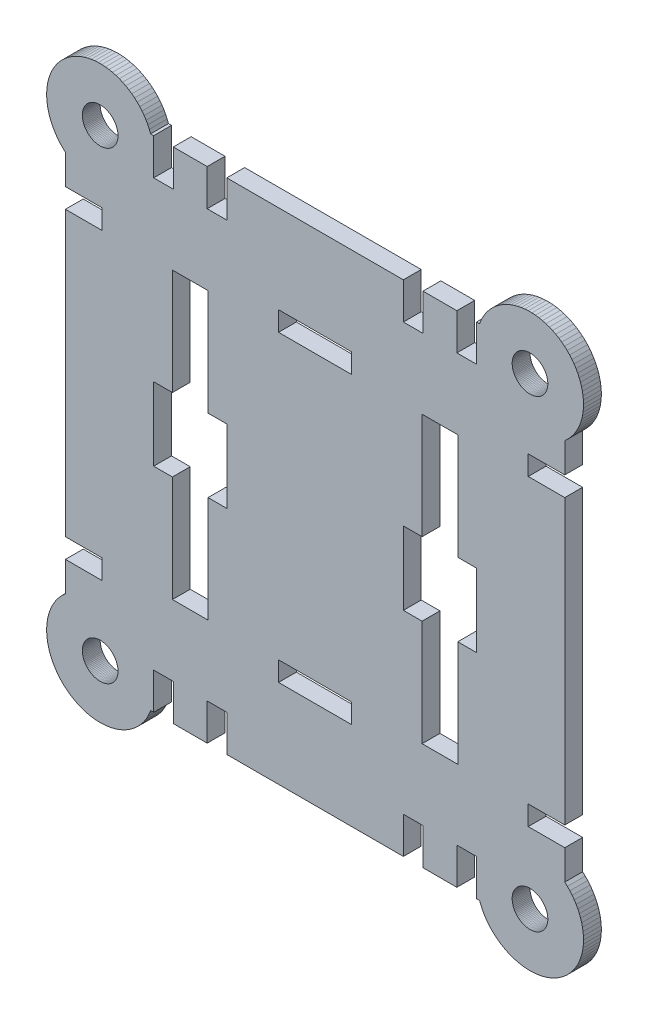
from build123d import *

# Parameters (mm, degrees)
SKETCH2_W           = 20.5
SKETCH2_H           = 5.5
BOSS_EXTRUDE1_DEPTH = 2.5


with BuildPart() as part:
    # Sketch2 → Boss-Extrude1 (new, symmetric)
    with BuildSketch(Plane.XY):
        Polygon((-1666.454340614, -187.547004833), (-1656.204340614, -187.547004833), (-1656.204340614, -182.047004833), (-1666.454340614, -182.047004833), (-1666.454340614, -102.54700992), (-1656.204340614, -102.54700992), (-1656.204340614, -97.04700992), (-1666.454340614, -97.04700992), (-1666.454342796, -88.695582594), (-1667.191682261, -88.021043185), (-1667.882472778, -87.29890255), (-1668.523646043, -86.532367827), (-1669.112356161, -85.724841337), (-1669.645990101, -84.879907343), (-1670.12217929, -84.001316146), (-1670.538810128, -83.092967435), (-1670.89403337, -82.158892981), (-1671.186272331, -81.203238742), (-1671.414229889, -80.230246456), (-1671.576894236, -79.24423482), (-1671.673543376, -78.249580318), (-1671.703748325, -77.250697793), (-1671.667375015, -76.252020859), (-1671.564584892, -75.257982215), (-1671.395834198, -74.272993972), (-1671.161871945, -73.301428071), (-1670.863736591, -72.347596877), (-1670.50275143, -71.415734038), (-1670.080518722, -70.509975695), (-1669.598912577, -69.634342121), (-1669.060070638, -68.792719877), (-1668.466384593, -67.988844565), (-1667.820489562, -67.226284244), (-1667.125252394, -66.508423591), (-1666.383758951, -65.838448883), (-1665.599300404, -65.21933385), (-1664.775358629, -64.653826479), (-1663.915590749, -64.144436815), (-1663.023812908, -63.693425821), (-1662.103983323, -63.302795341), (-1661.160184726, -62.974279216), (-1660.196606234, -62.709335589), (-1659.217524759, -62.509140432), (-1658.227286024, -62.374582324), (-1657.230285276, -62.306258512), (-1656.230947772, -62.304472256), (-1655.233709146, -62.369231484), (-1654.242995711, -62.500248758), (-1653.263204821, -62.696942547), (-1652.298685347, -62.958439814), (-1651.353718378, -63.283579882), (-1650.432498218, -63.670919596), (-1649.53911377, -64.118739719), (-1648.677530382, -64.625052569), (-1647.851572257, -65.187610842), (-1647.064905467, -65.803917582), (-1646.321021689, -66.471237267), (-1645.623222706, -67.186607951), (-1644.974605748, -67.946854409), (-1644.378049748, -68.748602234), (-1643.836202562, -69.58829281), (-1643.351469219, -70.46219911), (-1642.926001241, -71.366442239), (-1642.561687099, -72.297008648), (-1641.704340614, -72.297008648), (-1641.704340614, -82.547008648), (-1636.204340614, -82.547008648), (-1636.204340614, -72.297008648), (-1626.704340614, -72.297011192), (-1626.704340614, -82.547011192), (-1621.204340614, -82.547011192), (-1621.204340614, -72.297011192), (-1571.70434708, -72.297008648), (-1571.70434708, -82.547008648), (-1566.20434708, -82.547008648), (-1566.20434708, -72.297008648), (-1556.70434708, -72.297008648), (-1556.70434708, -82.547008648), (-1551.20434708, -82.547008648), (-1551.20434708, -72.297008648), (-1550.347000595, -72.297008648), (-1549.982686453, -71.366442239), (-1549.557218475, -70.46219911), (-1549.072485132, -69.58829281), (-1548.530637946, -68.748602234), (-1547.934081946, -67.946854409), (-1547.285464988, -67.186607951), (-1546.587666005, -66.471237267), (-1545.843782227, -65.803917582), (-1545.057115437, -65.187610842), (-1544.231157312, -64.62505257), (-1543.369573925, -64.118739719), (-1542.476189476, -63.670919596), (-1541.554969316, -63.283579882), (-1540.610002347, -62.958439814), (-1539.645482874, -62.696942547), (-1538.665691983, -62.500248758), (-1537.674978548, -62.369231484), (-1536.677739922, -62.304472256), (-1535.678402418, -62.306258512), (-1534.68140167, -62.374582324), (-1533.691162935, -62.509140432), (-1532.71208146, -62.709335589), (-1531.748502968, -62.974279216), (-1530.804704371, -63.302795341), (-1529.884874787, -63.693425821), (-1528.993096945, -64.144436815), (-1528.133329066, -64.653826479), (-1527.30938729, -65.21933385), (-1526.524928743, -65.838448883), (-1525.7834353, -66.508423591), (-1525.088198132, -67.226284244), (-1524.442303101, -67.988844565), (-1523.848617056, -68.792719877), (-1523.309775117, -69.634342121), (-1522.828168972, -70.509975695), (-1522.405936264, -71.415734038), (-1522.044951104, -72.347596877), (-1521.746815749, -73.301428071), (-1521.512853496, -74.272993972), (-1521.344102802, -75.257982215), (-1521.241312679, -76.252020859), (-1521.20493937, -77.250697793), (-1521.235144318, -78.249580318), (-1521.331793458, -79.24423482), (-1521.494457806, -80.230246456), (-1521.722415363, -81.203238742), (-1522.014654324, -82.158892981), (-1522.369877566, -83.092967435), (-1522.786508404, -84.001316146), (-1523.262697593, -84.879907343), (-1523.796331533, -85.724841337), (-1524.385041651, -86.532367827), (-1525.026214916, -87.29890255), (-1525.717005433, -88.021043185), (-1526.45434708, -88.69558446), (-1526.45434708, -97.04700992), (-1536.70434708, -97.04700992), (-1536.70434708, -102.54700992), (-1526.45434708, -102.54700992), (-1526.45434708, -182.047004833), (-1536.70434708, -182.047004833), (-1536.70434708, -187.547004833), (-1526.45434708, -187.547004833), (-1526.45434708, -195.898430293), (-1525.717005433, -196.572971568), (-1525.026214916, -197.295112203), (-1524.385041651, -198.061646926), (-1523.796331533, -198.869173416), (-1523.262697593, -199.71410741), (-1522.786508404, -200.592698608), (-1522.369877566, -201.501047319), (-1522.014654324, -202.435121772), (-1521.722415363, -203.390776011), (-1521.494457806, -204.363768297), (-1521.331793458, -205.349779933), (-1521.235144318, -206.344434436), (-1521.20493937, -207.34331696), (-1521.241312679, -208.341993894), (-1521.344102802, -209.336032538), (-1521.512853496, -210.321020781), (-1521.746815749, -211.292586682), (-1522.044951104, -212.246417876), (-1522.405936264, -213.178280715), (-1522.828168972, -214.084039058), (-1523.309775117, -214.959672633), (-1523.848617056, -215.801294876), (-1524.442303101, -216.605170188), (-1525.088198132, -217.367730509), (-1525.7834353, -218.085591162), (-1526.524928743, -218.755565871), (-1527.30938729, -219.374680903), (-1528.133329066, -219.940188274), (-1528.993096945, -220.449577938), (-1529.884874787, -220.900588932), (-1530.804704371, -221.291219412), (-1531.748502968, -221.619735537), (-1532.71208146, -221.884679164), (-1533.691162935, -222.084874321), (-1534.68140167, -222.219432429), (-1535.678402418, -222.287756241), (-1536.677739922, -222.289542497), (-1537.674978548, -222.224783269), (-1538.665691983, -222.093765996), (-1539.645482874, -221.897072206), (-1540.610002347, -221.63557494), (-1541.554969316, -221.310434871), (-1542.476189476, -220.923095158), (-1543.369573925, -220.475275035), (-1544.231157312, -219.968962184), (-1545.057115437, -219.406403911), (-1545.843782227, -218.790097171), (-1546.587666005, -218.122777486), (-1547.285464988, -217.407406802), (-1547.934081946, -216.647160344), (-1548.530637946, -215.845412519), (-1549.072485132, -215.005721943), (-1549.557218475, -214.131815643), (-1549.982686453, -213.227572514), (-1550.347000595, -212.297006105), (-1551.20434708, -212.297006105), (-1551.20434708, -202.047006105), (-1556.70434708, -202.047006105), (-1556.70434708, -212.297006105), (-1566.20434708, -212.297006105), (-1566.20434708, -202.047006105), (-1571.70434708, -202.047006105), (-1571.70434708, -212.297006105), (-1621.204340614, -212.297003561), (-1621.204340614, -202.047003561), (-1626.704340614, -202.047003561), (-1626.704340614, -212.297003561), (-1636.204340614, -212.297006105), (-1636.204340614, -202.047006105), (-1641.704340614, -202.047006105), (-1641.704340614, -212.297006105), (-1642.561687099, -212.297006105), (-1642.926001241, -213.227572514), (-1643.351469219, -214.131815643), (-1643.836202562, -215.005721943), (-1644.378049748, -215.845412519), (-1644.974605748, -216.647160344), (-1645.623222706, -217.407406802), (-1646.321021689, -218.122777486), (-1647.064905467, -218.790097171), (-1647.851572257, -219.406403911), (-1648.677530382, -219.968962184), (-1649.53911377, -220.475275035), (-1650.432498218, -220.923095158), (-1651.353718378, -221.310434871), (-1652.298685347, -221.63557494), (-1653.263204821, -221.897072206), (-1654.242995711, -222.093765996), (-1655.233709146, -222.224783269), (-1656.230947772, -222.289542497), (-1657.230285276, -222.287756241), (-1658.227286024, -222.219432429), (-1659.217524759, -222.084874321), (-1660.196606234, -221.884679164), (-1661.160184726, -221.619735537), (-1662.103983323, -221.291219412), (-1663.023812908, -220.900588932), (-1663.915590749, -220.449577938), (-1664.775358629, -219.940188274), (-1665.599300404, -219.374680903), (-1666.383758951, -218.75556587), (-1667.125252394, -218.085591162), (-1667.820489562, -217.367730509), (-1668.466384593, -216.605170188), (-1669.060070638, -215.801294876), (-1669.598912577, -214.959672633), (-1670.080518722, -214.084039058), (-1670.50275143, -213.178280715), (-1670.863736591, -212.246417876), (-1671.161871945, -211.292586682), (-1671.395834198, -210.321020781), (-1671.564584892, -209.336032538), (-1671.667375015, -208.341993894), (-1671.703748325, -207.34331696), (-1671.673543376, -206.344434436), (-1671.576894236, -205.349779933), (-1671.414229889, -204.363768297), (-1671.186272331, -203.390776011), (-1670.89403337, -202.435121772), (-1670.538810128, -201.501047319), (-1670.12217929, -200.592698608), (-1669.645990101, -199.71410741), (-1669.112356161, -198.869173416), (-1668.523646043, -198.061646926), (-1667.882472778, -197.295112203), (-1667.191682261, -196.572971568), (-1666.454342796, -195.898432159), align=None)
        Polygon((-1636.454340614, -152.547004833), (-1641.704340614, -152.547004833), (-1641.704340614, -132.04700992), (-1636.454340614, -132.04700992), (-1636.454340614, -102.297011192), (-1626.454340614, -102.297011192), (-1626.454340614, -132.04700992), (-1621.204340614, -132.04700992), (-1621.204340614, -152.547004833), (-1626.454340614, -152.547004833), (-1626.454340614, -182.297003561), (-1636.454340614, -182.297003561), align=None, mode=Mode.SUBTRACT)
        with Locations((-1596.454343847, -184.797004833)):
            Rectangle(SKETCH2_W, SKETCH2_H, mode=Mode.SUBTRACT)
        with Locations((-1596.454343847, -99.79700992)):
            Rectangle(SKETCH2_W, SKETCH2_H, mode=Mode.SUBTRACT)
        Polygon((-1566.45434708, -152.547007377), (-1571.70434708, -152.547007377), (-1571.70434708, -132.047007377), (-1566.45434708, -132.047007377), (-1566.45434708, -102.297008648), (-1556.45434708, -102.297008648), (-1556.45434708, -132.047007377), (-1551.20434708, -132.047007377), (-1551.20434708, -152.547007377), (-1556.45434708, -152.547007377), (-1556.45434708, -182.297006105), (-1566.45434708, -182.297006105), align=None, mode=Mode.SUBTRACT)
        Polygon((-1660.239353746, -73.761482898), (-1660.000548915, -73.537817766), (-1659.747626985, -73.330250102), (-1659.481671005, -73.139668742), (-1659.20381984, -72.966889785), (-1658.915263291, -72.812653096), (-1658.617237002, -72.677619141), (-1658.311017166, -72.562366156), (-1657.997915065, -72.467387672), (-1657.67927145, -72.393090402), (-1657.356450801, -72.339792497), (-1657.030835486, -72.307722187), (-1656.70381984, -72.297016804), (-1656.376804194, -72.307722187), (-1656.051188879, -72.339792497), (-1655.72836823, -72.393090402), (-1655.409724614, -72.467387672), (-1655.096622513, -72.562366156), (-1654.790402678, -72.677619141), (-1654.492376389, -72.812653096), (-1654.20381984, -72.966889785), (-1653.925968675, -73.139668742), (-1653.660012695, -73.330250102), (-1653.407090764, -73.537817766), (-1653.168285934, -73.761482898), (-1652.944620802, -74.000287728), (-1652.737053138, -74.253209658), (-1652.546471778, -74.519165638), (-1652.373692821, -74.797016804), (-1652.219456132, -75.085573352), (-1652.084422177, -75.383599642), (-1651.969169192, -75.689819477), (-1651.874190708, -76.002921578), (-1651.799893438, -76.321565193), (-1651.746595533, -76.644385842), (-1651.714525224, -76.970001157), (-1651.70381984, -77.297016804), (-1651.714525224, -77.62403245), (-1651.746595533, -77.949647765), (-1651.799893438, -78.272468414), (-1651.874190708, -78.591112029), (-1651.969169192, -78.90421413), (-1652.084422177, -79.210433965), (-1652.219456132, -79.508460255), (-1652.373692821, -79.797016804), (-1652.546471778, -80.074867969), (-1652.737053138, -80.340823949), (-1652.944620802, -80.593745879), (-1653.168285934, -80.832550709), (-1653.407090764, -81.056215841), (-1653.660012695, -81.263783505), (-1653.925968675, -81.454364865), (-1654.20381984, -81.627143822), (-1654.492376389, -81.781380511), (-1654.790402678, -81.916414466), (-1655.096622513, -82.031667451), (-1655.409724614, -82.126645935), (-1655.72836823, -82.200943206), (-1656.051188879, -82.25424111), (-1656.376804194, -82.28631142), (-1656.70381984, -82.297016804), (-1657.030835486, -82.28631142), (-1657.356450801, -82.25424111), (-1657.67927145, -82.200943206), (-1657.997915065, -82.126645935), (-1658.311017166, -82.031667451), (-1658.617237002, -81.916414466), (-1658.915263291, -81.781380511), (-1659.20381984, -81.627143822), (-1659.481671005, -81.454364865), (-1659.747626985, -81.263783505), (-1660.000548915, -81.056215841), (-1660.239353746, -80.832550709), (-1660.463018877, -80.593745879), (-1660.670586541, -80.340823949), (-1660.861167901, -80.074867969), (-1661.033946859, -79.797016804), (-1661.188183547, -79.508460255), (-1661.323217502, -79.210433965), (-1661.438470487, -78.90421413), (-1661.533448971, -78.591112029), (-1661.607746242, -78.272468414), (-1661.661044147, -77.949647765), (-1661.693114456, -77.62403245), (-1661.70381984, -77.297016804), (-1661.693114456, -76.970001157), (-1661.661044147, -76.644385842), (-1661.607746242, -76.321565193), (-1661.533448971, -76.002921578), (-1661.438470487, -75.689819477), (-1661.323217502, -75.383599642), (-1661.188183547, -75.085573352), (-1661.033946859, -74.797016804), (-1660.861167901, -74.519165638), (-1660.670586541, -74.253209658), (-1660.463018877, -74.000287728), align=None, mode=Mode.SUBTRACT)
        Polygon((-1657.67927145, -202.393071548), (-1657.356450801, -202.339773643), (-1657.030835486, -202.307703333), (-1656.70381984, -202.29699795), (-1656.376804194, -202.307703333), (-1656.051188879, -202.339773643), (-1655.72836823, -202.393071548), (-1655.409724614, -202.467368818), (-1655.096622513, -202.562347302), (-1654.790402678, -202.677600287), (-1654.492376389, -202.812634242), (-1654.20381984, -202.966870931), (-1653.925968675, -203.139649888), (-1653.660012695, -203.330231248), (-1653.407090764, -203.537798912), (-1653.168285934, -203.761464044), (-1652.944620802, -204.000268874), (-1652.737053138, -204.253190805), (-1652.546471778, -204.519146785), (-1652.373692821, -204.79699795), (-1652.219456132, -205.085554499), (-1652.084422177, -205.383580788), (-1651.969169192, -205.689800623), (-1651.874190708, -206.002902724), (-1651.799893438, -206.32154634), (-1651.746595533, -206.644366989), (-1651.714525224, -206.969982304), (-1651.70381984, -207.29699795), (-1651.714525224, -207.624013596), (-1651.746595533, -207.949628911), (-1651.799893438, -208.27244956), (-1651.874190708, -208.591093175), (-1651.969169192, -208.904195276), (-1652.084422177, -209.210415111), (-1652.219456132, -209.508441401), (-1652.373692821, -209.79699795), (-1652.546471778, -210.074849115), (-1652.737053138, -210.340805095), (-1652.944620802, -210.593727025), (-1653.168285934, -210.832531856), (-1653.407090764, -211.056196987), (-1653.660012695, -211.263764651), (-1653.925968675, -211.454346011), (-1654.20381984, -211.627124969), (-1654.492376389, -211.781361657), (-1654.790402678, -211.916395612), (-1655.096622513, -212.031648597), (-1655.409724614, -212.126627081), (-1655.72836823, -212.200924352), (-1656.051188879, -212.254222257), (-1656.376804194, -212.286292566), (-1656.70381984, -212.29699795), (-1657.030835486, -212.286292566), (-1657.356450801, -212.254222257), (-1657.67927145, -212.200924352), (-1657.997915065, -212.126627081), (-1658.311017166, -212.031648597), (-1658.617237002, -211.916395612), (-1658.915263291, -211.781361657), (-1659.20381984, -211.627124969), (-1659.481671005, -211.454346011), (-1659.747626985, -211.263764651), (-1660.000548915, -211.056196987), (-1660.239353746, -210.832531856), (-1660.463018877, -210.593727025), (-1660.670586541, -210.340805095), (-1660.861167901, -210.074849115), (-1661.033946859, -209.79699795), (-1661.188183547, -209.508441401), (-1661.323217502, -209.210415111), (-1661.438470487, -208.904195276), (-1661.533448971, -208.591093175), (-1661.607746242, -208.27244956), (-1661.661044147, -207.949628911), (-1661.693114456, -207.624013596), (-1661.70381984, -207.29699795), (-1661.693114456, -206.969982304), (-1661.661044147, -206.644366989), (-1661.607746242, -206.32154634), (-1661.533448971, -206.002902724), (-1661.438470487, -205.689800623), (-1661.323217502, -205.383580788), (-1661.188183547, -205.085554499), (-1661.033946859, -204.79699795), (-1660.861167901, -204.519146785), (-1660.670586541, -204.253190805), (-1660.463018877, -204.000268874), (-1660.239353746, -203.761464044), (-1660.000548915, -203.537798912), (-1659.747626985, -203.330231248), (-1659.481671005, -203.139649888), (-1659.20381984, -202.966870931), (-1658.915263291, -202.812634242), (-1658.617237002, -202.677600287), (-1658.311017166, -202.562347302), (-1657.997915065, -202.467368818), align=None, mode=Mode.SUBTRACT)
        Polygon((-1536.204867854, -72.297016804), (-1535.877852208, -72.307722187), (-1535.552236893, -72.339792497), (-1535.229416244, -72.393090402), (-1534.910772629, -72.467387672), (-1534.597670528, -72.562366156), (-1534.291450693, -72.677619141), (-1533.993424403, -72.812653096), (-1533.704867854, -72.966889785), (-1533.427016689, -73.139668742), (-1533.161060709, -73.330250102), (-1532.908138779, -73.537817766), (-1532.669333948, -73.761482898), (-1532.445668817, -74.000287728), (-1532.238101153, -74.253209658), (-1532.047519793, -74.519165638), (-1531.874740835, -74.797016804), (-1531.720504147, -75.085573352), (-1531.585470192, -75.383599642), (-1531.470217207, -75.689819477), (-1531.375238723, -76.002921578), (-1531.300941452, -76.321565193), (-1531.247643547, -76.644385842), (-1531.215573238, -76.970001157), (-1531.204867854, -77.297016804), (-1531.215573238, -77.62403245), (-1531.247643547, -77.949647765), (-1531.300941452, -78.272468414), (-1531.375238723, -78.591112029), (-1531.470217207, -78.90421413), (-1531.585470192, -79.210433965), (-1531.720504147, -79.508460255), (-1531.874740835, -79.797016804), (-1532.047519793, -80.074867969), (-1532.238101153, -80.340823949), (-1532.445668817, -80.593745879), (-1532.669333948, -80.832550709), (-1532.908138779, -81.056215841), (-1533.161060709, -81.263783505), (-1533.427016689, -81.454364865), (-1533.704867854, -81.627143822), (-1533.993424403, -81.781380511), (-1534.291450693, -81.916414466), (-1534.597670528, -82.031667451), (-1534.910772629, -82.126645935), (-1535.229416244, -82.200943206), (-1535.552236893, -82.25424111), (-1535.877852208, -82.28631142), (-1536.204867854, -82.297016804), (-1536.531883501, -82.28631142), (-1536.857498815, -82.25424111), (-1537.180319464, -82.200943206), (-1537.49896308, -82.126645935), (-1537.812065181, -82.031667451), (-1538.118285016, -81.916414466), (-1538.416311305, -81.781380511), (-1538.704867854, -81.627143822), (-1538.982719019, -81.454364865), (-1539.248674999, -81.263783505), (-1539.50159693, -81.056215841), (-1539.74040176, -80.832550709), (-1539.964066892, -80.593745879), (-1540.171634556, -80.340823949), (-1540.362215916, -80.074867969), (-1540.534994873, -79.797016804), (-1540.689231562, -79.508460255), (-1540.824265517, -79.210433965), (-1540.939518502, -78.90421413), (-1541.034496986, -78.591112029), (-1541.108794256, -78.272468414), (-1541.162092161, -77.949647765), (-1541.194162471, -77.62403245), (-1541.204867854, -77.297016804), (-1541.194162471, -76.970001157), (-1541.162092161, -76.644385842), (-1541.108794256, -76.321565193), (-1541.034496986, -76.002921578), (-1540.939518502, -75.689819477), (-1540.824265517, -75.383599642), (-1540.689231562, -75.085573352), (-1540.534994873, -74.797016804), (-1540.362215916, -74.519165638), (-1540.171634556, -74.253209658), (-1539.964066892, -74.000287728), (-1539.74040176, -73.761482898), (-1539.50159693, -73.537817766), (-1539.248674999, -73.330250102), (-1538.982719019, -73.139668742), (-1538.704867854, -72.966889785), (-1538.416311305, -72.812653096), (-1538.118285016, -72.677619141), (-1537.812065181, -72.562366156), (-1537.49896308, -72.467387672), (-1537.180319464, -72.393090402), (-1536.857498815, -72.339792497), (-1536.531883501, -72.307722187), align=None, mode=Mode.SUBTRACT)
        Polygon((-1539.248674999, -211.263764651), (-1539.50159693, -211.056196987), (-1539.74040176, -210.832531856), (-1539.964066892, -210.593727025), (-1540.171634556, -210.340805095), (-1540.362215916, -210.074849115), (-1540.534994873, -209.79699795), (-1540.689231562, -209.508441401), (-1540.824265517, -209.210415111), (-1540.939518502, -208.904195276), (-1541.034496986, -208.591093175), (-1541.108794256, -208.27244956), (-1541.162092161, -207.949628911), (-1541.194162471, -207.624013596), (-1541.204867854, -207.29699795), (-1541.194162471, -206.969982304), (-1541.162092161, -206.644366989), (-1541.108794256, -206.32154634), (-1541.034496986, -206.002902724), (-1540.939518502, -205.689800623), (-1540.824265517, -205.383580788), (-1540.689231562, -205.085554499), (-1540.534994873, -204.79699795), (-1540.362215916, -204.519146785), (-1540.171634556, -204.253190805), (-1539.964066892, -204.000268874), (-1539.74040176, -203.761464044), (-1539.50159693, -203.537798912), (-1539.248674999, -203.330231248), (-1538.982719019, -203.139649888), (-1538.704867854, -202.966870931), (-1538.416311305, -202.812634242), (-1538.118285016, -202.677600287), (-1537.812065181, -202.562347302), (-1537.49896308, -202.467368818), (-1537.180319464, -202.393071548), (-1536.857498815, -202.339773643), (-1536.531883501, -202.307703333), (-1536.204867854, -202.29699795), (-1535.877852208, -202.307703333), (-1535.552236893, -202.339773643), (-1535.229416244, -202.393071548), (-1534.910772629, -202.467368818), (-1534.597670528, -202.562347302), (-1534.291450693, -202.677600287), (-1533.993424403, -202.812634242), (-1533.704867854, -202.966870931), (-1533.427016689, -203.139649888), (-1533.161060709, -203.330231248), (-1532.908138779, -203.537798912), (-1532.669333948, -203.761464044), (-1532.445668817, -204.000268874), (-1532.238101153, -204.253190805), (-1532.047519793, -204.519146785), (-1531.874740835, -204.79699795), (-1531.720504147, -205.085554499), (-1531.585470192, -205.383580788), (-1531.470217207, -205.689800623), (-1531.375238723, -206.002902724), (-1531.300941452, -206.32154634), (-1531.247643547, -206.644366989), (-1531.215573238, -206.969982304), (-1531.204867854, -207.29699795), (-1531.215573238, -207.624013596), (-1531.247643547, -207.949628911), (-1531.300941452, -208.27244956), (-1531.375238723, -208.591093175), (-1531.470217207, -208.904195276), (-1531.585470192, -209.210415111), (-1531.720504147, -209.508441401), (-1531.874740835, -209.79699795), (-1532.047519793, -210.074849115), (-1532.238101153, -210.340805095), (-1532.445668817, -210.593727025), (-1532.669333948, -210.832531856), (-1532.908138779, -211.056196987), (-1533.161060709, -211.263764651), (-1533.427016689, -211.454346011), (-1533.704867854, -211.627124969), (-1533.993424403, -211.781361657), (-1534.291450693, -211.916395612), (-1534.597670528, -212.031648597), (-1534.910772629, -212.126627081), (-1535.229416244, -212.200924352), (-1535.552236893, -212.254222257), (-1535.877852208, -212.286292566), (-1536.204867854, -212.29699795), (-1536.531883501, -212.286292566), (-1536.857498815, -212.254222257), (-1537.180319464, -212.200924352), (-1537.49896308, -212.126627081), (-1537.812065181, -212.031648597), (-1538.118285016, -211.916395612), (-1538.416311305, -211.781361657), (-1538.704867854, -211.627124969), (-1538.982719019, -211.454346011), align=None, mode=Mode.SUBTRACT)
    extrude(amount=BOSS_EXTRUDE1_DEPTH, both=True)


solid = part.part
